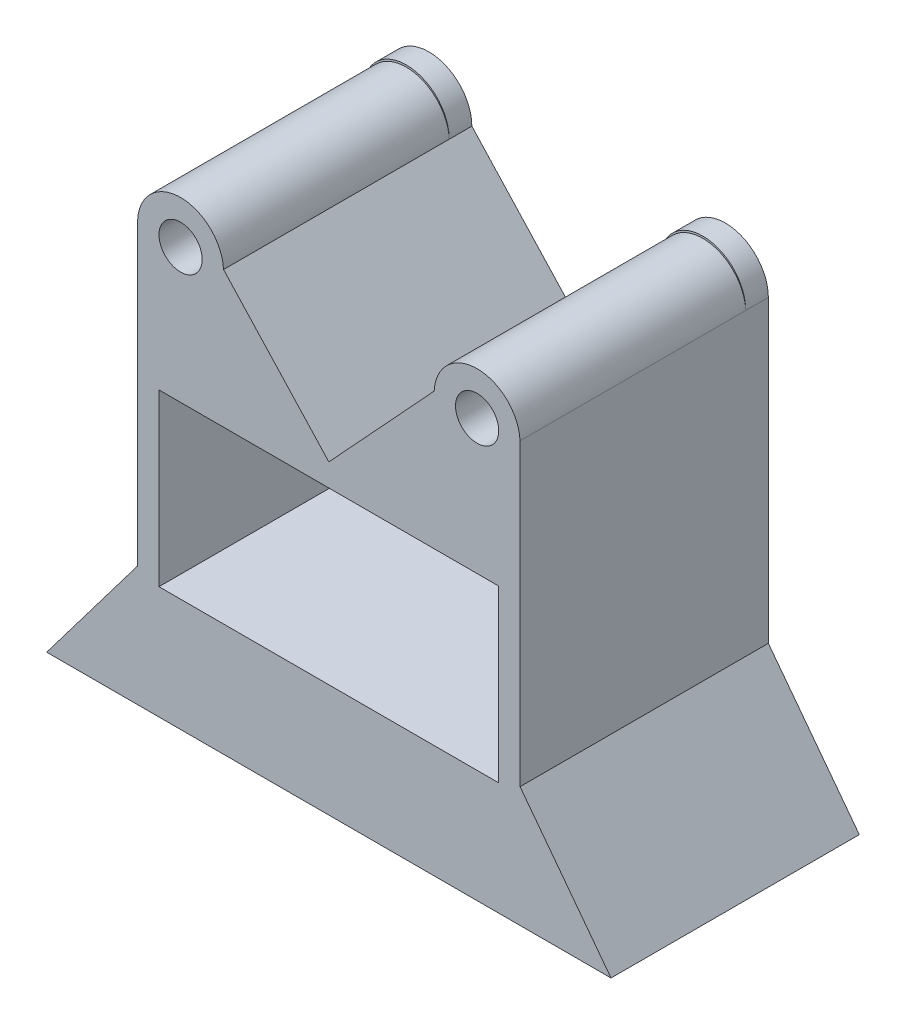
from build123d import *

# Parameters (mm, degrees)
SKETCH1_R           = 4.862500054
SKETCH1_W           = 76.454
SKETCH1_H           = 38.354
BOSS_EXTRUDE1_DEPTH = 50.8
BOSS_EXTRUDE2_DEPTH = 5.08


with BuildPart() as part:
    # Sketch1 → Boss-Extrude1 (new body)
    with BuildSketch(Plane.XY):
        with BuildLine():
            Line((-43.029964919, -17.522331458), (-43.029964919, 19.177))
            Line((-43.029964919, 19.177), (-43.029964919, 49.89109769))
            ThreePointArc((-43.029964919, 49.89109769), (-33.369881409, 59.115507734), (-23.699543278, 49.901848605))
            Line((-23.699543278, 49.901848605), (0, 24.257))
            Line((0, 24.257), (23.699543278, 49.901848605))
            ThreePointArc((23.699543278, 49.901848605), (33.369881409, 59.115507734), (43.029964919, 49.89109769))
            Line((43.029964919, 49.89109769), (43.029964919, 19.177))
            Line((43.029964919, 19.177), (43.029964919, -17.522331458))
            Line((43.029964919, -17.522331458), (63.5, -44.577))
            Line((63.5, -44.577), (-63.5, -44.577))
            Line((-63.5, -44.577), (-43.029964919, -17.522331458))
        make_face()
        with Locations((-33.364499946, 49.439500054)):
            Circle(SKETCH1_R, mode=Mode.SUBTRACT)
        with Locations(Location((33.364499946, 49.439500054, 0), (0, 0, 180))):
            Circle(SKETCH1_R, mode=Mode.SUBTRACT)
        Rectangle(SKETCH1_W, SKETCH1_H, mode=Mode.SUBTRACT)
    extrude(amount=BOSS_EXTRUDE1_DEPTH)

    # Sketch2 → Boss-Extrude2 (add)
    with BuildSketch(Plane(origin=(0, 0, 0), x_dir=(-1, 0, 0), z_dir=(0, 0, -1))):
        with BuildLine():
            Line((-43.029964919, 49.89109769), (-43.029964919, -17.522331458))
            Line((-43.029964919, -17.522331458), (-63.5, -44.577))
            Line((-63.5, -44.577), (63.5, -44.577))
            Line((63.5, -44.577), (43.029964919, -17.522331458))
            Line((43.029964919, -17.522331458), (43.029964919, 49.89109769))
            ThreePointArc((43.029964919, 49.89109769), (33.370126568, 59.556310005), (23.699543278, 49.901848605))
            Line((23.699543278, 49.901848605), (0, 24.257))
            Line((0, 24.257), (-23.699543278, 49.901848605))
            ThreePointArc((-23.699543278, 49.901848605), (-33.370126568, 59.556310005), (-43.029964919, 49.89109769))
        make_face()
    extrude(amount=BOSS_EXTRUDE2_DEPTH)


solid = part.part
